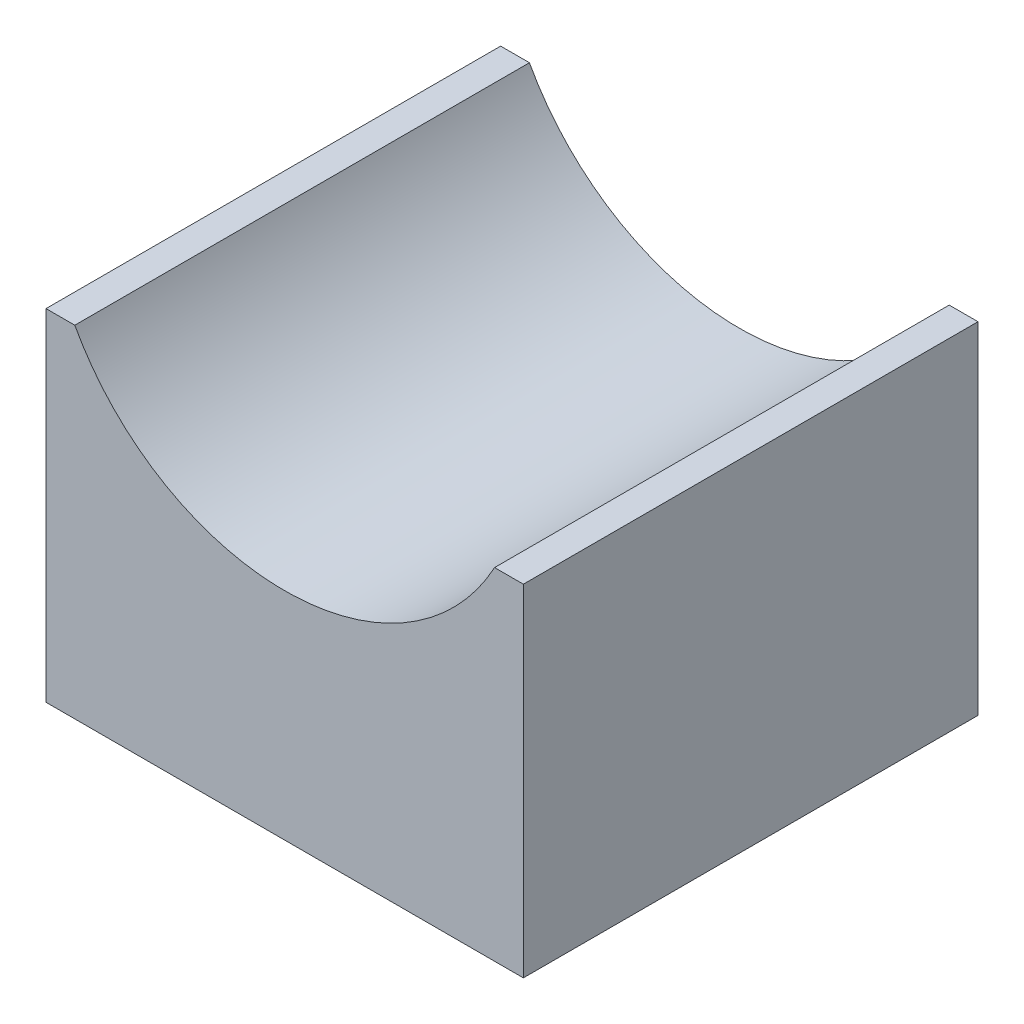
from build123d import *

# Parameters (mm, degrees)
EXTRUDE_1_DEPTH = 10


with BuildPart() as part:
    # 草图1 → 凸台-拉伸1 (new, symmetric)
    with BuildSketch(Plane.XY):
        with BuildLine():
            Line((-10.5, 15), (-10.5, 0))
            Line((-10.5, 0), (10.5, 0))
            Line((10.5, 0), (10.5, 15))
            Line((10.5, 15), (9.233092656, 15))
            ThreePointArc((9.233092656, 15), (0, 9.5), (-9.233092656, 15))
            Line((-9.233092656, 15), (-10.5, 15))
        make_face()
    extrude(amount=EXTRUDE_1_DEPTH, both=True)


solid = part.part
